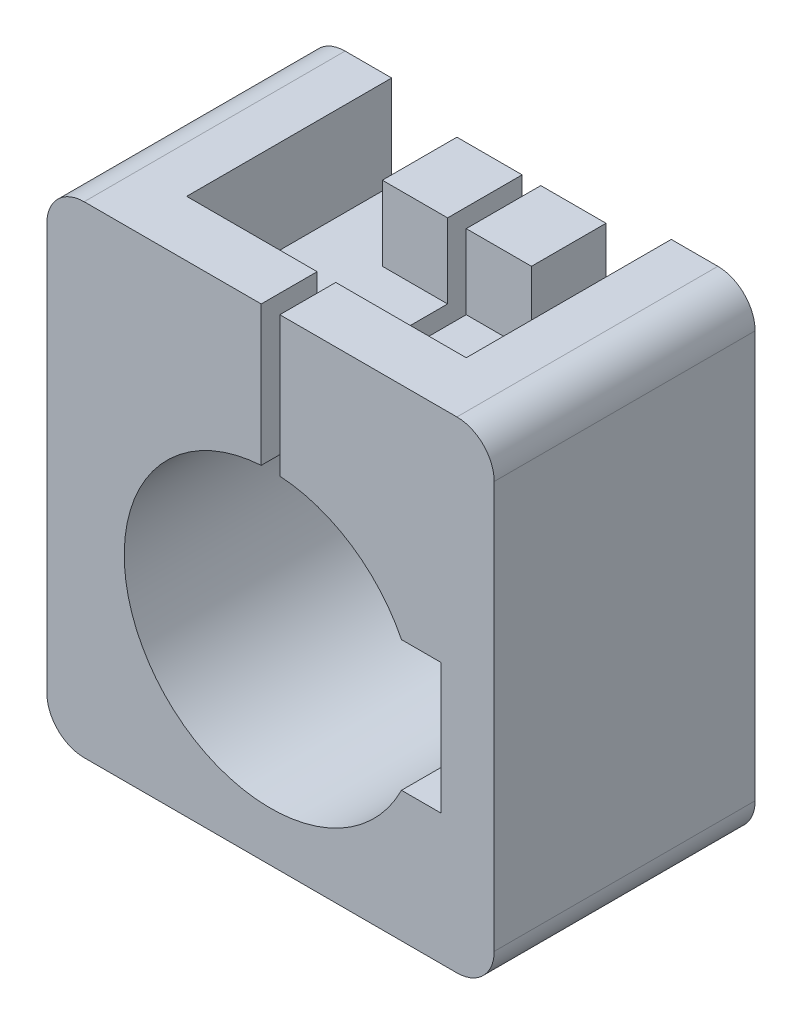
from build123d import *

# Parameters (mm, degrees)
SALIENTE_EXTRUIR1_DEPTH = 7
CROQUIS2_W              = 3.5
CROQUIS2_H              = 4
SALIENTE_EXTRUIR2_DEPTH = 4
CROQUIS3_W              = 11.5
CROQUIS3_H              = 5
SALIENTE_EXTRUIR3_DEPTH = 3
SALIENTE_EXTRUIR4_START = -7
CROQUIS4_W              = 4.5
CROQUIS4_H              = 5
SALIENTE_EXTRUIR4_DEPTH = 11
REDONDEO3_R             = 2


with BuildPart() as part:
    # Croquis1 → Saliente-Extruir1 (new, symmetric)
    with BuildSketch(Plane.XY):
        with BuildLine():
            Line((-12, -10.5), (12, -10.5))
            Line((12, -10.5), (12, 10.33406025))
            Line((12, 10.33406025), (0.5, 10.33406025))
            Line((0.5, 10.33406025), (0.5, 7.83406025))
            ThreePointArc((0.5, 7.83406025), (4.342612549, 6.539435468), (7.026556767, 3.5))
            Line((7.026556767, 3.5), (9.15, 3.5))
            Line((9.15, 3.5), (9.15, -3.5))
            Line((9.15, -3.5), (7.026556767, -3.5))
            ThreePointArc((7.026556767, -3.5), (-6.539435468, -4.342612549), (-0.5, 7.83406025))
            Line((-0.5, 7.83406025), (-0.5, 10.33406025))
            Line((-0.5, 10.33406025), (-12, 10.33406025))
            Line((-12, 10.33406025), (-12, -10.5))
        make_face()
    extrude(amount=SALIENTE_EXTRUIR1_DEPTH, both=True)

    # Croquis2 → Saliente-Extruir2 (add)
    with BuildSketch(Plane.XY.offset(-7)):
        with Locations((2.25, 12.33406025)):
            Rectangle(CROQUIS2_W, CROQUIS2_H)
        with Locations((-2.25, 12.33406025)):
            Rectangle(CROQUIS2_W, CROQUIS2_H)
    extrude(amount=SALIENTE_EXTRUIR2_DEPTH)

    # Croquis3 → Saliente-Extruir3 (add)
    with BuildSketch(Plane(origin=(0, 0, 7), x_dir=(-1, 0, 0), z_dir=(0, 0, -1))):
        with Locations((-6.25, 12.83406025)):
            Rectangle(CROQUIS3_W, CROQUIS3_H)
        with Locations((6.25, 12.83406025)):
            Rectangle(CROQUIS3_W, CROQUIS3_H)
    extrude(amount=SALIENTE_EXTRUIR3_DEPTH)

    # Croquis4 → Saliente-Extruir4 (add)
    with BuildSketch(Plane.XY.offset(SALIENTE_EXTRUIR4_START)):
        with Locations((-9.75, 12.83406025)):
            Rectangle(CROQUIS4_W, CROQUIS4_H)
        with Locations((9.75, 12.83406025)):
            Rectangle(CROQUIS4_W, CROQUIS4_H)
    extrude(amount=SALIENTE_EXTRUIR4_DEPTH)

    # Redondeo3
    redondeo3_edges = [part.edges().sort_by_distance(p)[0] for p in [
        (12, -10.5, 0),
        (-12, -10.5, 0),
        (12, 15.33406025, 0),
        (-12, 15.33406025, 0),
    ]]
    fillet(redondeo3_edges, radius=REDONDEO3_R)


solid = part.part
